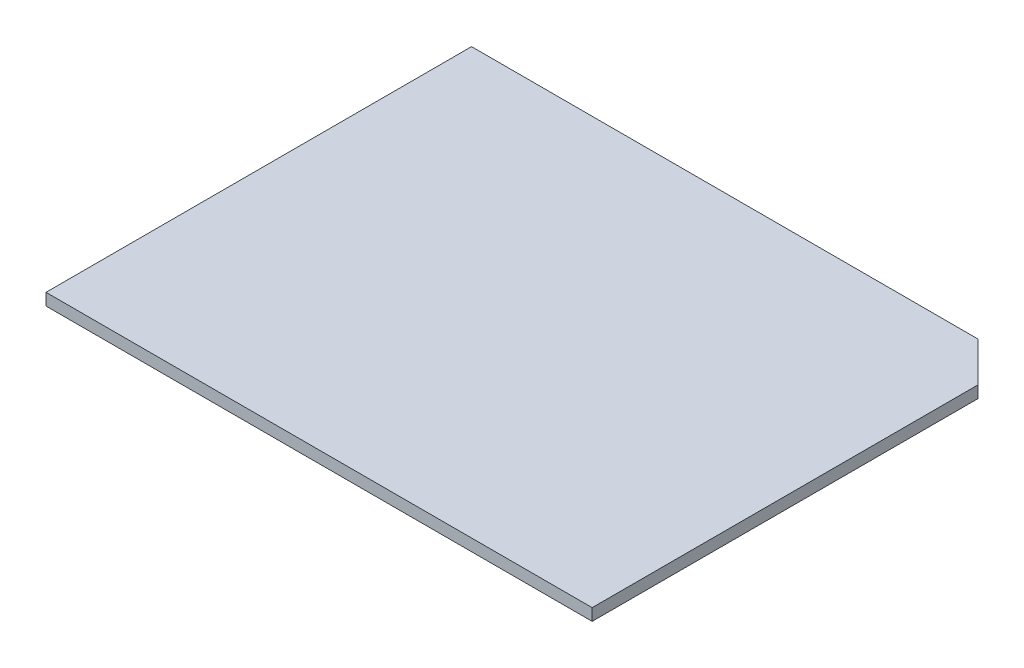
from build123d import *

# Parameters (mm, degrees)
BOSS_EXTRUDE1_DEPTH = 1.5


with BuildPart() as part:
    # Sketch1 → Boss-Extrude1 (new body)
    with BuildSketch(Plane(origin=(0, 0, 0), x_dir=(1, 0, 0), z_dir=(0, 1, 0))):
        Polygon((-58.648901605, 9.632016997), (-58.648901605, -43.957983003), (10.131098395, -43.957983003), (10.131098395, 4.632016997), (5.131098395, 9.632016997), align=None)
    extrude(amount=BOSS_EXTRUDE1_DEPTH)


solid = part.part
